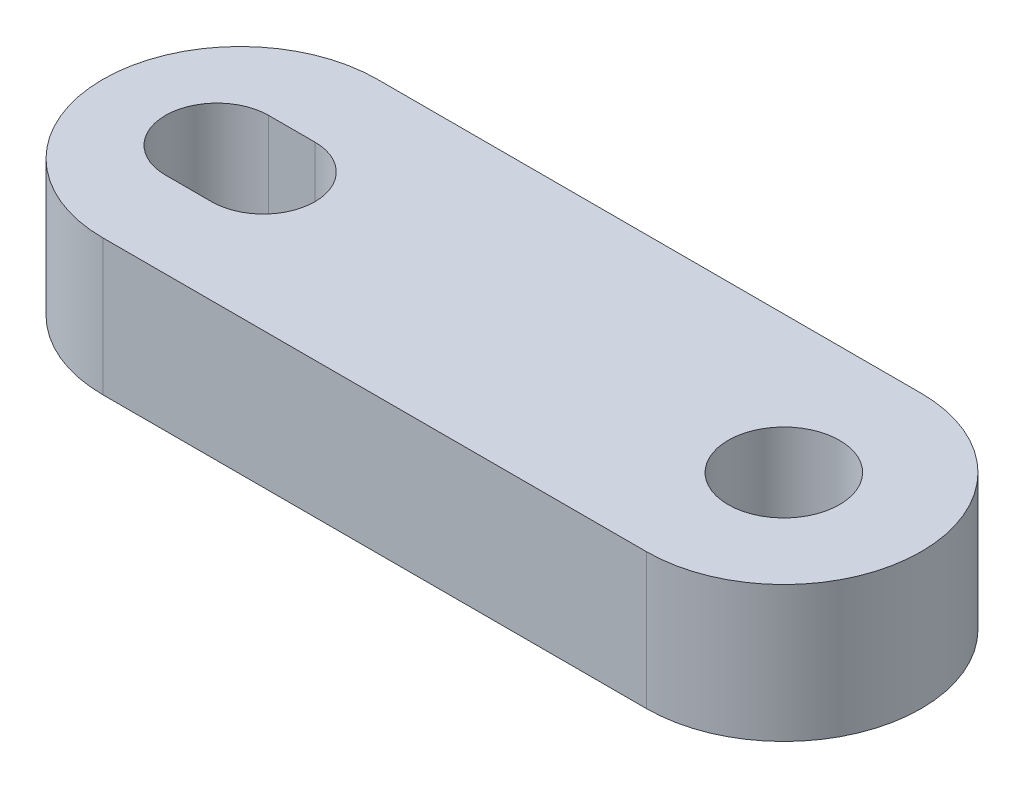
from build123d import *

# Parameters (mm, degrees)
SKETCH_1_R      = 2.05
EXTRUDE_1_DEPTH = 5


with BuildPart() as part:
    # 草圖1 → 填料-伸長1 (new body)
    with BuildSketch(Plane(origin=(0, 0, 0), x_dir=(1, 0, 0), z_dir=(0, 1, 0))):
        with BuildLine():
            Line((-10, 5.05), (10, 5.05))
            ThreePointArc((10, 5.05), (15.05, 0), (10, -5.05))
            Line((10, -5.05), (-10, -5.05))
            ThreePointArc((-10, -5.05), (-15.05, 0), (-10, 5.05))
        make_face()
        with Locations(Location((10, 0, 0), (0, 0, 270))):
            Circle(SKETCH_1_R, mode=Mode.SUBTRACT)
        with BuildLine():
            Line((-10.85, 1.9), (-9.15, 1.9))
            ThreePointArc((-9.15, 1.9), (-7.25, 0), (-9.15, -1.9))
            Line((-9.15, -1.9), (-10.85, -1.9))
            ThreePointArc((-10.85, -1.9), (-12.75, 0), (-10.85, 1.9))
        make_face(mode=Mode.SUBTRACT)
    extrude(amount=EXTRUDE_1_DEPTH)


solid = part.part
